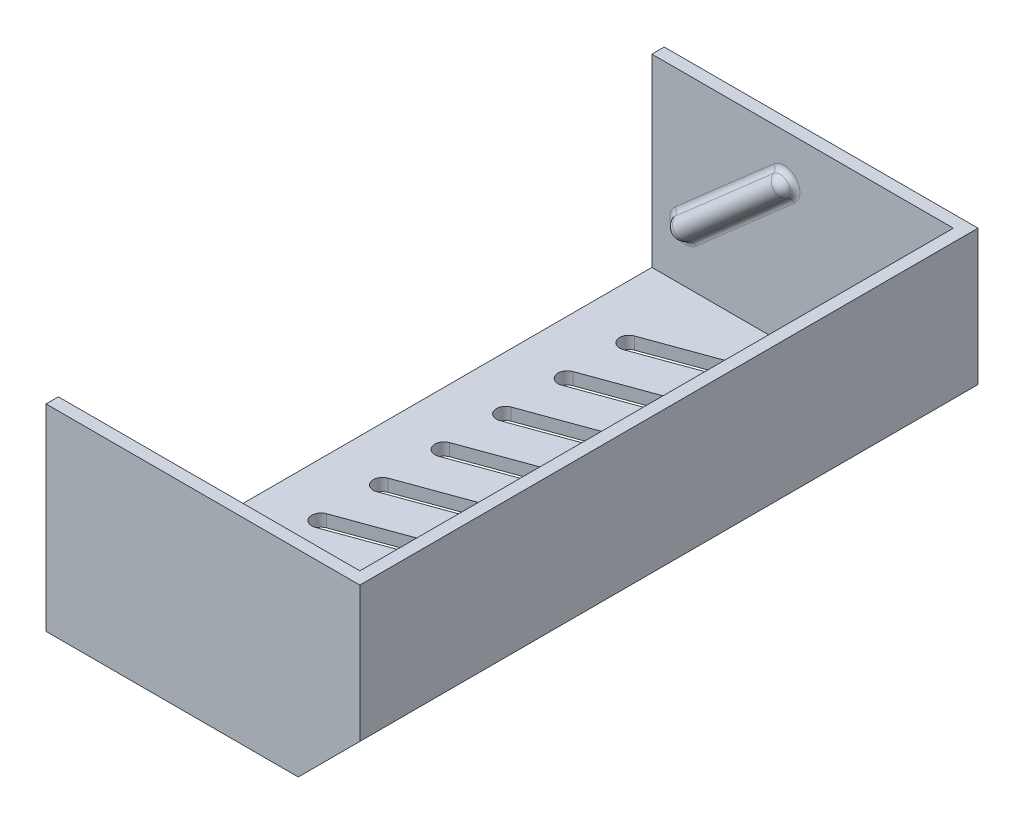
from build123d import *

# Parameters (mm, degrees)
BOSS_EXTRUDE1_DEPTH = 30
SKETCH3_W           = 50.97
SKETCH3_H           = 100.4
BOSS_EXTRUDE2_DEPTH = 2
REVOLVE1_ANGLE      = 358
FILLET1_R           = 1
CUT_EXTRUDE1_DEPTH  = 101
BOSS_EXTRUDE3_REACH = 170.96
CUT_EXTRUDE2_DEPTH  = 2
LPATTERN1_COUNT     = 5
LPATTERN1_PITCH     = 10
LPATTERN2_COUNT     = 5
LPATTERN2_PITCH     = 10
SKETCH9_R           = 2
SKETCH9_R_2         = 4
CUT_EXTRUDE3_DEPTH  = 1


with BuildPart() as part:
    # Sketch2 → Boss-Extrude1 (new body)
    with BuildSketch(Plane.XZ.offset(30)):
        Polygon((-133.57, -96.2), (-84.6, -96.2), (-84.6, 0.2), (-133.57, 0.2), (-133.57, 2.2), (-82.6, 2.2), (-82.6, -98.2), (-133.57, -98.2), align=None)
    extrude(amount=-BOSS_EXTRUDE1_DEPTH)

    # Sketch3 → Boss-Extrude2 (add)
    with BuildSketch(Plane.XZ.offset(30)):
        with Locations((-108.085, -48)):
            Rectangle(SKETCH3_W, SKETCH3_H)
    extrude(amount=BOSS_EXTRUDE2_DEPTH)

    # Sketch4 → Revolve1 (revolve)
    with BuildSketch(Plane(origin=(0, 0, 0.2), x_dir=(-1, 0, 0), z_dir=(0, 0, -1))):
        with BuildLine():
            ThreePointArc((126.946389188, -22.830754007), (128.214647144, -23.261442668), (129.415983818, -22.669191741))
            Line((129.415983818, -22.669191741), (110.772864663, -6.315578448))
            ThreePointArc((110.772864663, -6.315578448), (110.342176002, -7.583836403), (110.934426929, -8.785173077))
            Line((110.934426929, -8.785173077), (126.946389188, -22.830754007))
        make_face()
    revolve1 = revolve(axis=Axis((-128.10040537, -21.515175559, 0.2), (0.7517591128712743, 0.6594378183081363, 0)), revolution_arc=REVOLVE1_ANGLE)

    # Mirror3: Revolve1 across plane
    add(revolve1.mirror(Plane(origin=(0, 0, -48), x_dir=(1, 0, 0), z_dir=(0, 0, -1))))

    # Fillet1
    fillet1_edges = [part.edges().sort_by_distance(p)[0] for p in [
        (-128.214647144, -23.261442668, 0.2),
        (-121.248440423, -13.176806647, 0.2),
        (-111.974201337, -5.72332752, 0.2),
        (-118.940408059, -15.807963542, 0.2),
        (-128.214647144, -23.261442668, -96.2),
        (-121.248440423, -13.176806647, -96.2),
        (-111.974201337, -5.72332752, -96.2),
        (-118.940408059, -15.807963542, -96.2),
    ]]
    fillet(fillet1_edges, radius=FILLET1_R)

    # Sketch5 → Cut-Extrude1 (cut)
    with BuildSketch(Plane(origin=(0, 0, -98.2), x_dir=(-1, 0, 0), z_dir=(0, 0, -1))):
        Polygon((92.6, -32), (82.6, -22), (82.6, -32), align=None)
    extrude(amount=-CUT_EXTRUDE1_DEPTH, mode=Mode.SUBTRACT)

    # Sketch7 → Boss-Extrude3 (add, up to next)
    with BuildSketch(Plane(origin=(0, 0, 0.2), x_dir=(-1, 0, 0), z_dir=(0, 0, -1)), mode=Mode.PRIVATE) as boss_extrude3_sk1:
        Polygon((93.428427125, -30), (84.6, -21.171572875), (84.6, -24), (90.6, -30), align=None)
    boss_extrude3_tool1 = extrude(boss_extrude3_sk1.sketch, amount=BOSS_EXTRUDE3_REACH, mode=Mode.PRIVATE) - part.part
    add(boss_extrude3_tool1.solids().sort_by_distance((-88.352065, -26.247935, 0.2))[0])

    # Sketch8 → Cut-Extrude2 (cut)
    with BuildSketch(Plane.XZ.offset(32)):
        with BuildLine():
            Line((-101.851872455, -53.684790723), (-125.344187975, -45.13428714))
            ThreePointArc((-125.344187975, -45.13428714), (-126.240696691, -43.211717993), (-124.318127545, -42.315209277))
            Line((-124.318127545, -42.315209277), (-100.825812025, -50.86571286))
            ThreePointArc((-100.825812025, -50.86571286), (-99.929303309, -52.788282007), (-101.851872455, -53.684790723))
        make_face()
    cut_extrude2 = extrude(amount=-CUT_EXTRUDE2_DEPTH, mode=Mode.SUBTRACT)

    # LPattern1: Cut-Extrude2 ×5
    with Locations(*[(0, 0, -i * LPATTERN1_PITCH) for i in range(1, LPATTERN1_COUNT)]):
        add(cut_extrude2, mode=Mode.SUBTRACT)

    # LPattern2: Cut-Extrude2 ×5
    with Locations(*[(0, 0, i * LPATTERN2_PITCH) for i in range(1, LPATTERN2_COUNT)]):
        add(cut_extrude2, mode=Mode.SUBTRACT)

    # Sketch9 → Cut-Extrude3 (cut)
    with BuildSketch(Plane(origin=(0, 0, -98.2), x_dir=(-1, 0, 0), z_dir=(0, 0, -1))):
        with Locations((111.05096655, -7)):
            Circle(SKETCH9_R)
        with Locations((111.05096655, -23)):
            Circle(SKETCH9_R_2)
        with Locations((111.05096655, -13)):
            Circle(SKETCH9_R)
        Polygon((127.147055737, -27), (121.090407141, -27), (122.676520454, -19.790973413), (116.946384418, -19.790973413), (122.811770426, -5), (122.811770426, -15.583196494), (127.147055737, -15.583196494), align=None)
        Polygon((113.010558344, -12.6), (114.970150138, -22.2), (107.131782961, -22.2), (109.091374756, -12.6), align=None)
    extrude(amount=-CUT_EXTRUDE3_DEPTH, mode=Mode.SUBTRACT)


solid = part.part
